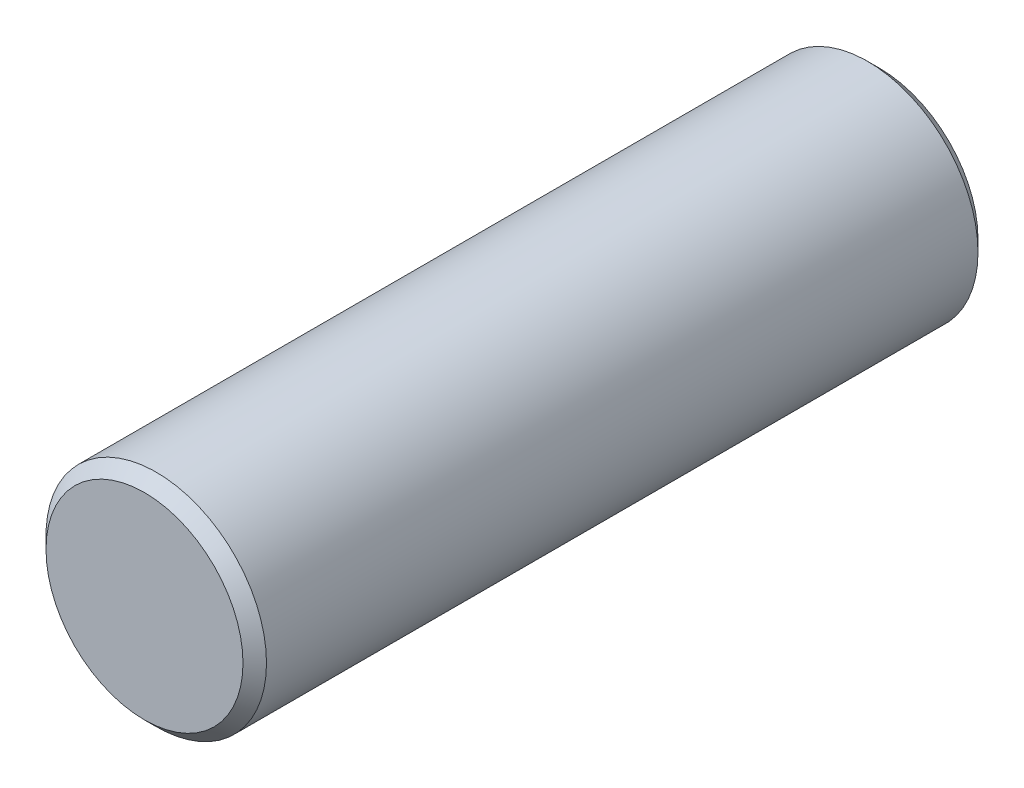
from build123d import *

# Parameters (mm, degrees)
SKETCH1_R           = 2.38125
BOSS_EXTRUDE1_DEPTH = 15.875
CHAMFER2_SIZE       = 0.254


with BuildPart() as part:
    # Sketch1 → Boss-Extrude1 (new body)
    with BuildSketch(Plane.XY):
        Circle(SKETCH1_R)
    extrude(amount=BOSS_EXTRUDE1_DEPTH)

    # Chamfer2
    chamfer2_edges = [part.edges().sort_by_distance(p)[0] for p in [
        (-2.38125, 0, 0),
        (-2.38125, 0, 15.875),
    ]]
    chamfer(chamfer2_edges, length=CHAMFER2_SIZE)


solid = part.part
